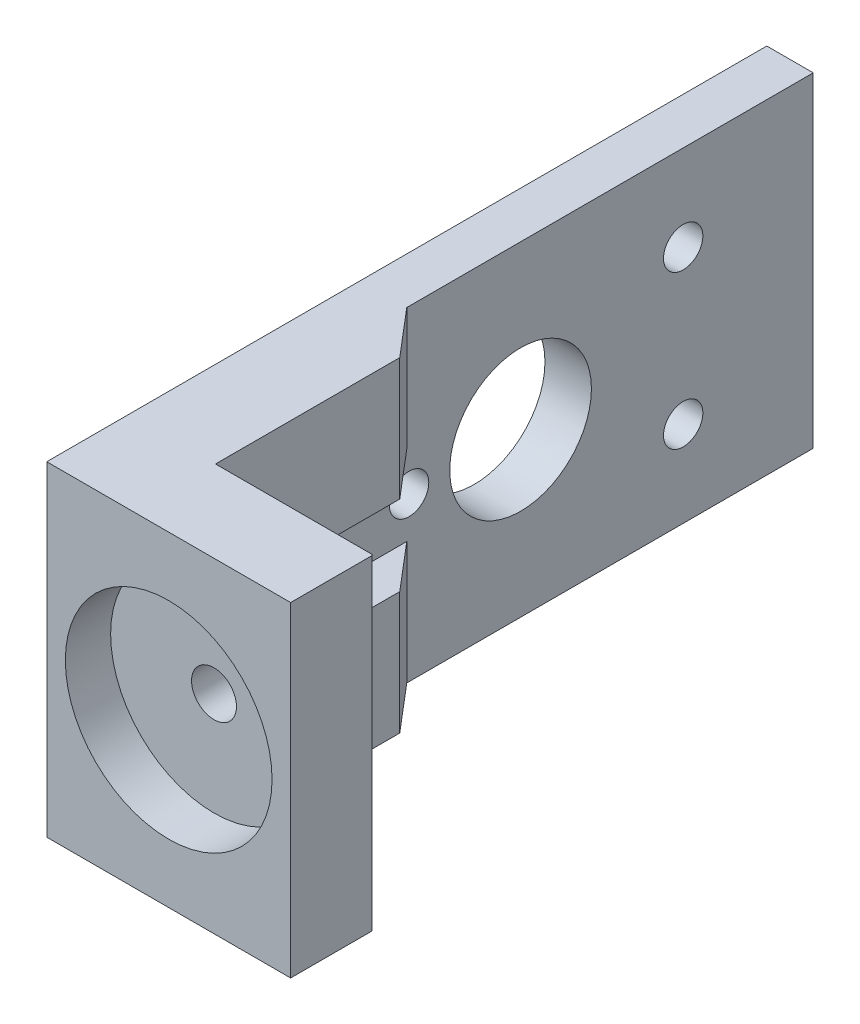
from build123d import *

# Parameters (mm, degrees)
SKETCH1_W                 = 5.08
SKETCH1_H                 = 78.74
SKETCH1_W_2               = 21.59
SKETCH1_H_2               = 8.89
BOSS_EXTRUDE1_DEPTH       = 35.56
SKETCH2_R                 = 11.303
CUT_EXTRUDE1_DEPTH        = 4.953
F_8_CLEARANCE_HOLE1_D     = 4.9149
CUT_EXTRUDE4_REACH        = 91.054
SKETCH5_R                 = 7.747
F_6_CLEARANCE_HOLE1_D     = 4.3053
F_6_CLEARANCE_HOLE1_DEPTH = 5.08
BOSS_EXTRUDE3_DEPTH       = 13.3985
BOSS_EXTRUDE4_DEPTH       = 13.3985
SKETCH21_R                = 38.1
CUT_EXTRUDE5_DEPTH        = 91.420075758
SKETCH22_W                = 17.828699099
SKETCH22_H                = 30.684129503
CUT_EXTRUDE6_DEPTH        = 121.92


with BuildPart() as part:
    # Sketch1 → Boss-Extrude1 (new body)
    with BuildSketch(Plane(origin=(0, 0, 0), x_dir=(1, 0, 0), z_dir=(0, 1, 0))):
        with Locations((2.54, 39.37)):
            Rectangle(SKETCH1_W, SKETCH1_H)
        with Locations((15.875, 4.445)):
            Rectangle(SKETCH1_W_2, SKETCH1_H_2)
    extrude(amount=BOSS_EXTRUDE1_DEPTH)

    # Sketch2 → Cut-Extrude1 (cut)
    with BuildSketch(Plane.XY):
        with Locations((13.335, 17.78)):
            Circle(SKETCH2_R)
    extrude(amount=-CUT_EXTRUDE1_DEPTH, mode=Mode.SUBTRACT)

    # #8 Clearance Hole1 (through all)
    with Locations(Plane.XY.offset(-4.953)):
        with Locations((13.335, 17.78)):
            Hole(F_8_CLEARANCE_HOLE1_D / 2)

    # Sketch5 → Cut-Extrude4 (cut, up to next)
    with BuildSketch(Plane(origin=(5.08, 0, 0), x_dir=(0, 0, -1), z_dir=(1, 0, 0)), mode=Mode.PRIVATE) as cut_extrude4_sk1:
        with Locations((46.736, 17.78)):
            Circle(SKETCH5_R)
    cut_extrude4_tool1 = extrude(cut_extrude4_sk1.sketch, amount=-CUT_EXTRUDE4_REACH, mode=Mode.PRIVATE) & part.part
    # Sketch5 → Cut-Extrude4 (cut, up to next)
    with BuildSketch(Plane(origin=(5.08, 0, 0), x_dir=(0, 0, -1), z_dir=(1, 0, 0)), mode=Mode.PRIVATE) as cut_extrude4_sk2:
        with BuildLine():
            ThreePointArc((54.483, 17.78), (46.736, 25.527), (38.989, 17.78))
            Line((38.989, 17.78), (54.483, 17.78))
        make_face()
    cut_extrude4_tool2 = extrude(cut_extrude4_sk2.sketch, amount=-CUT_EXTRUDE4_REACH, mode=Mode.PRIVATE) & part.part
    # Sketch5 → Cut-Extrude4 (cut, up to next)
    with BuildSketch(Plane(origin=(5.08, 0, 0), x_dir=(0, 0, -1), z_dir=(1, 0, 0)), mode=Mode.PRIVATE) as cut_extrude4_sk3:
        with BuildLine():
            Line((54.483, 17.78), (38.989, 17.78))
            ThreePointArc((38.989, 17.78), (46.736, 10.033), (54.483, 17.78))
        make_face()
    cut_extrude4_tool3 = extrude(cut_extrude4_sk3.sketch, amount=-CUT_EXTRUDE4_REACH, mode=Mode.PRIVATE) & part.part
    add(cut_extrude4_tool1.solids().sort_by_distance((5.08, 17.78, -46.736))[0], mode=Mode.SUBTRACT)
    add(cut_extrude4_tool2.solids().sort_by_distance((5.08, 21.067929, -46.736))[0], mode=Mode.SUBTRACT)
    add(cut_extrude4_tool3.solids().sort_by_distance((5.08, 14.492071, -46.736))[0], mode=Mode.SUBTRACT)

    # #6 Clearance Hole1
    with Locations(Plane(origin=(5.08, 0, 0), x_dir=(0, 0, -1), z_dir=(1, 0, 0))):
        with Locations((34.544, 17.78), (46.736, 17.78), (64.516, 26.162), (64.516, 9.398)):
            Hole(F_6_CLEARANCE_HOLE1_D / 2, depth=F_6_CLEARANCE_HOLE1_DEPTH)

    # Sketch17 → Boss-Extrude3 (add)
    with BuildSketch(Plane(origin=(0, 35.56, 0), x_dir=(1, 0, 0), z_dir=(0, 1, 0))):
        Polygon((5.08, 8.89), (5.08, 34.29), (26.67, 8.89), align=None)
    extrude(amount=-BOSS_EXTRUDE3_DEPTH)

    # Sketch18 → Boss-Extrude4 (add)
    with BuildSketch(Plane.XZ):
        Polygon((26.67, -8.89), (5.08, -8.89), (5.08, -34.29), align=None)
    extrude(amount=-BOSS_EXTRUDE4_DEPTH)

    # Sketch21 → Cut-Extrude5 (cut, through all)
    with BuildSketch(Plane(origin=(0, 35.56, 0), x_dir=(1, 0, 0), z_dir=(0, 1, 0))):
        with Locations((44.937862921, 45.023006442)):
            Circle(SKETCH21_R)
    extrude(amount=-CUT_EXTRUDE5_DEPTH, mode=Mode.SUBTRACT)

    # Sketch22 → Cut-Extrude6 (cut)
    with BuildSketch(Plane(origin=(0, 35.56, 0), x_dir=(1, 0, 0), z_dir=(0, 1, 0))):
        with Locations((18.355186326, 24.356358653)):
            Rectangle(SKETCH22_W, SKETCH22_H)
    extrude(amount=-CUT_EXTRUDE6_DEPTH, mode=Mode.SUBTRACT)


solid = part.part
